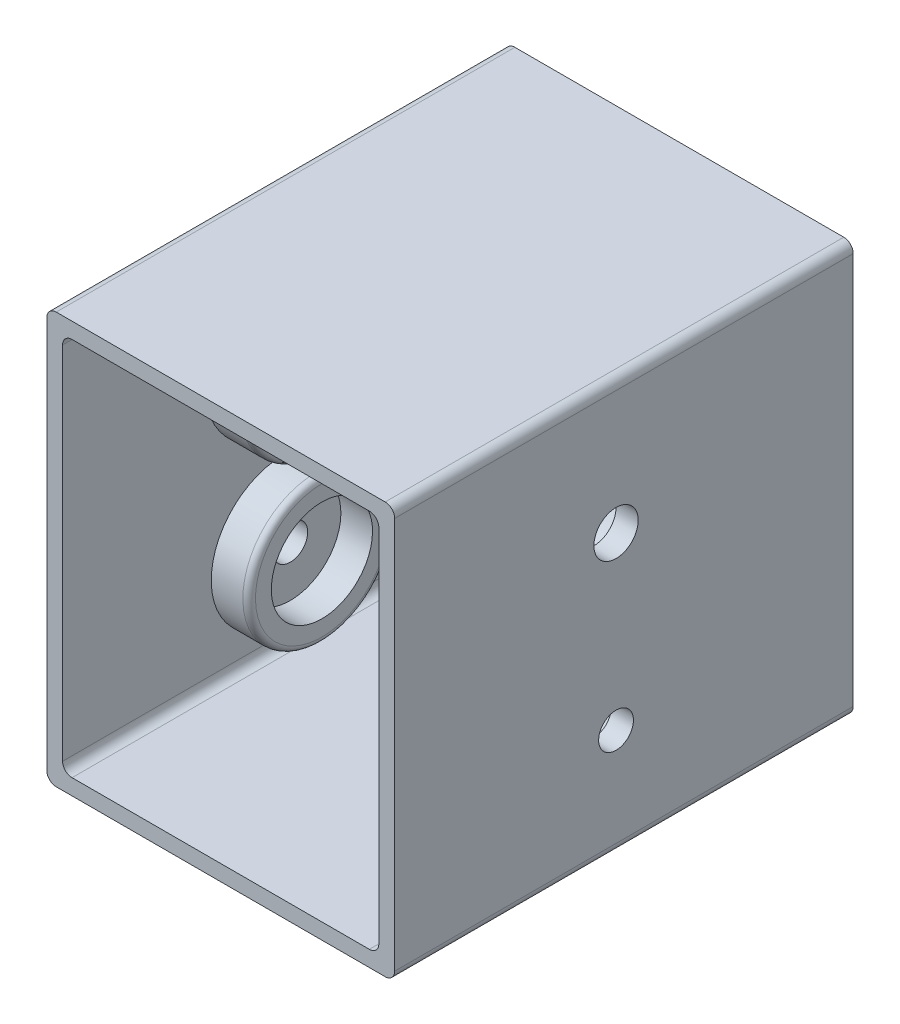
from build123d import *

# Parameters (mm, degrees)
SKETCH1_W                 = 130
SKETCH1_H                 = 110
BOSS_EXTRUDE1_DEPTH       = 145
SHELL2_T                  = -5
SHELL2_THICKNESS_2_FACE_W = 100
SHELL2_THICKNESS_2_FACE_H = 120
SHELL2_THICKNESS_2_DEPTH  = 5
SKETCH2_R                 = 23
BOSS_EXTRUDE2_DEPTH       = 12
SKETCH2_3_R               = 25
BOSS_EXTRUDE3_DEPTH       = 13
SKETCH3_R                 = 16
CUT_EXTRUDE1_DEPTH        = 10
SKETCH4_R                 = 17.5
CUT_EXTRUDE4_DEPTH        = 11
SKETCH5_R                 = 5.5
SKETCH5_R_2               = 7
CUT_EXTRUDE5_DEPTH        = 194.261480901
SKETCH7_R                 = 4.25
CUT_EXTRUDE6_DEPTH        = 10
FILLET1_R                 = 3
FILLET2_R                 = 2


with BuildPart() as part:
    # Sketch1 → Boss-Extrude1 (new body)
    with BuildSketch(Plane(origin=(0, 0, 0), x_dir=(0, 1, 0), z_dir=(0, 0, 1))):
        Rectangle(SKETCH1_W, SKETCH1_H)
    extrude(amount=BOSS_EXTRUDE1_DEPTH)

    # Shell2
    shell2_openings = [part.faces().sort_by_distance(p)[0] for p in [
        (0, 0, 145),
    ]]
    offset(amount=SHELL2_T, openings=shell2_openings, kind=Kind.INTERSECTION)

    # Shell2 thickness 2 face (on inner face of the shell) → Shell2 thickness 2 (add)
    with BuildSketch(Plane(origin=(0, 0, 5), x_dir=(-1, 0, 0), z_dir=(0, 0, -1))):
        Rectangle(SHELL2_THICKNESS_2_FACE_W, SHELL2_THICKNESS_2_FACE_H)
    extrude(amount=-SHELL2_THICKNESS_2_DEPTH)

    # Sketch2 → Boss-Extrude2 (add)
    with BuildSketch(Plane.YZ.offset(-50)):
        with Locations((-31, 75)):
            Circle(SKETCH2_R)
    boss_extrude2 = extrude(amount=BOSS_EXTRUDE2_DEPTH)

    # Sketch2<3> → Boss-Extrude3 (add)
    with BuildSketch(Plane.YZ.offset(-50)):
        with Locations((23, 75)):
            Circle(SKETCH2_3_R)
    boss_extrude3 = extrude(amount=BOSS_EXTRUDE3_DEPTH)

    # Sketch3 → Cut-Extrude1 (cut)
    with BuildSketch(Plane.YZ.offset(-38)):
        with Locations((-31, 75)):
            Circle(SKETCH3_R)
    cut_extrude1 = extrude(amount=-CUT_EXTRUDE1_DEPTH, mode=Mode.SUBTRACT)

    # Sketch4 → Cut-Extrude4 (cut)
    with BuildSketch(Plane.YZ.offset(-37)):
        with Locations((23, 75)):
            Circle(SKETCH4_R)
    cut_extrude4 = extrude(amount=-CUT_EXTRUDE4_DEPTH, mode=Mode.SUBTRACT)

    # Mirror1: Boss-Extrude2, Boss-Extrude3, Cut-Extrude1, Cut-Extrude4 across plane
    add(boss_extrude2.mirror(Plane(origin=(0, 0, 0), x_dir=(0, 0, 1), z_dir=(1, 0, 0))))
    add(boss_extrude3.mirror(Plane(origin=(0, 0, 0), x_dir=(0, 0, 1), z_dir=(1, 0, 0))))
    add(cut_extrude1.mirror(Plane(origin=(0, 0, 0), x_dir=(0, 0, 1), z_dir=(1, 0, 0))), mode=Mode.SUBTRACT)
    add(cut_extrude4.mirror(Plane(origin=(0, 0, 0), x_dir=(0, 0, 1), z_dir=(1, 0, 0))), mode=Mode.SUBTRACT)

    # Sketch5 → Cut-Extrude5 (cut, through all)
    with BuildSketch(Plane(origin=(-55, 0, 0), x_dir=(0, -1, 0), z_dir=(-1, 0, 0))):
        with Locations((31, 75)):
            Circle(SKETCH5_R)
        with Locations((-23, 75)):
            Circle(SKETCH5_R_2)
    extrude(amount=-CUT_EXTRUDE5_DEPTH, mode=Mode.SUBTRACT)

    # Sketch7 → Cut-Extrude6 (cut)
    with BuildSketch(Plane(origin=(0, 0, 0), x_dir=(1, 0, 0), z_dir=(0, 0, -1))):
        with Locations((-40, 50)):
            Circle(SKETCH7_R)
        with Locations((40, 50)):
            Circle(SKETCH7_R)
        with Locations((-40, -50)):
            Circle(SKETCH7_R)
        with Locations((40, -50)):
            Circle(SKETCH7_R)
    extrude(amount=-CUT_EXTRUDE6_DEPTH, mode=Mode.SUBTRACT)

    # Fillet1
    fillet1_edges = [part.edges().sort_by_distance(p)[0] for p in [
        (-55, 65, 72.5),
        (55, 65, 72.5),
        (55, -65, 72.5),
        (-55, -65, 72.5),
        (50, 60, 77.5),
        (50, -60, 77.5),
        (-50, -60, 77.5),
        (-50, 60, 77.5),
    ]]
    fillet(fillet1_edges, radius=FILLET1_R)

    # Fillet2
    fillet2_edges = [part.edges().sort_by_distance(p)[0] for p in [
        (38, -54, 75),
        (37, -2, 75),
        (-38, -54, 75),
        (-37, -2, 75),
    ]]
    fillet(fillet2_edges, radius=FILLET2_R)


solid = part.part
